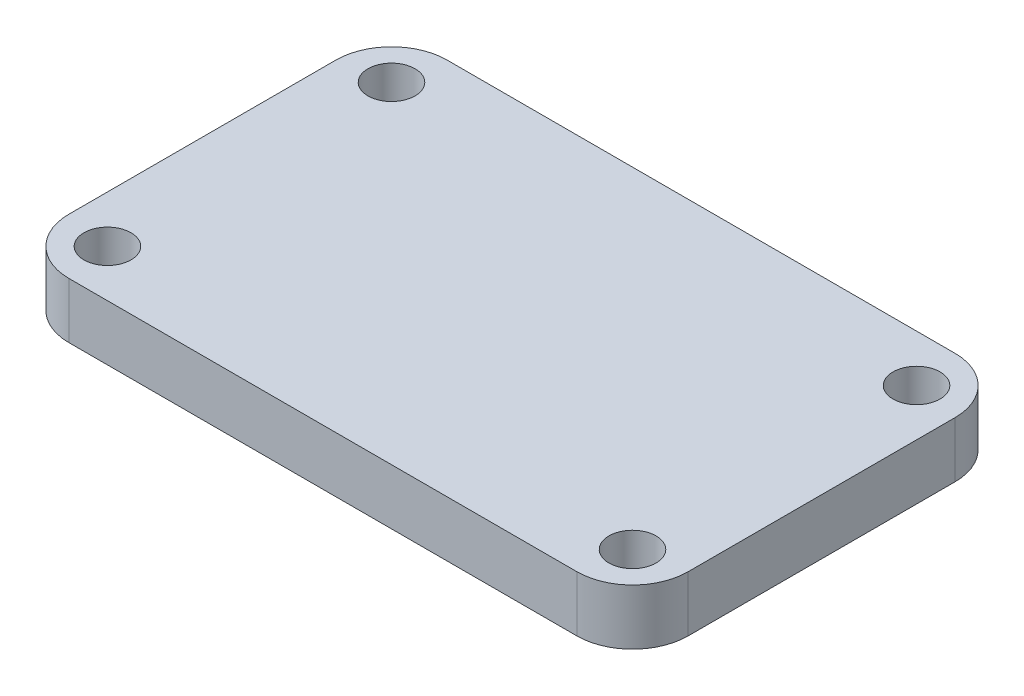
from build123d import *

# Parameters (mm, degrees)
SKETCH1_W           = 33.4
SKETCH1_H           = 20.4
BOSS_EXTRUDE1_DEPTH = 3
SKETCH4_R           = 1.27
CUT_EXTRUDE1_DEPTH  = 40.252006318
FILLET5_R           = 3


with BuildPart() as part:
    # Sketch1 → Boss-Extrude1 (new body)
    with BuildSketch(Plane(origin=(0, 0, 0), x_dir=(1, 0, 0), z_dir=(0, 1, 0))):
        with Locations((16.7, 10.2)):
            Rectangle(SKETCH1_W, SKETCH1_H)
    extrude(amount=BOSS_EXTRUDE1_DEPTH)

    # Sketch4 → Cut-Extrude1 (cut, through all)
    with BuildSketch(Plane(origin=(0, 3, 0), x_dir=(1, 0, 0), z_dir=(0, 1, 0))):
        with Locations(Location((2.54, 17.86, 0), (0, 0, 270))):
            Circle(SKETCH4_R)
        with Locations(Location((2.54, 2.54, 0), (0, 0, 270))):
            Circle(SKETCH4_R)
        with Locations(Location((30.86, 17.86, 0), (0, 0, 270))):
            Circle(SKETCH4_R)
        with Locations(Location((30.86, 2.54, 0), (0, 0, 270))):
            Circle(SKETCH4_R)
    extrude(amount=-CUT_EXTRUDE1_DEPTH, mode=Mode.SUBTRACT)

    # Fillet5
    fillet5_edges = [part.edges().sort_by_distance(p)[0] for p in [
        (0, 1.5, 0),
        (0, 1.5, -20.4),
        (33.4, 1.5, -20.4),
        (33.4, 1.5, 0),
    ]]
    fillet(fillet5_edges, radius=FILLET5_R)


solid = part.part
